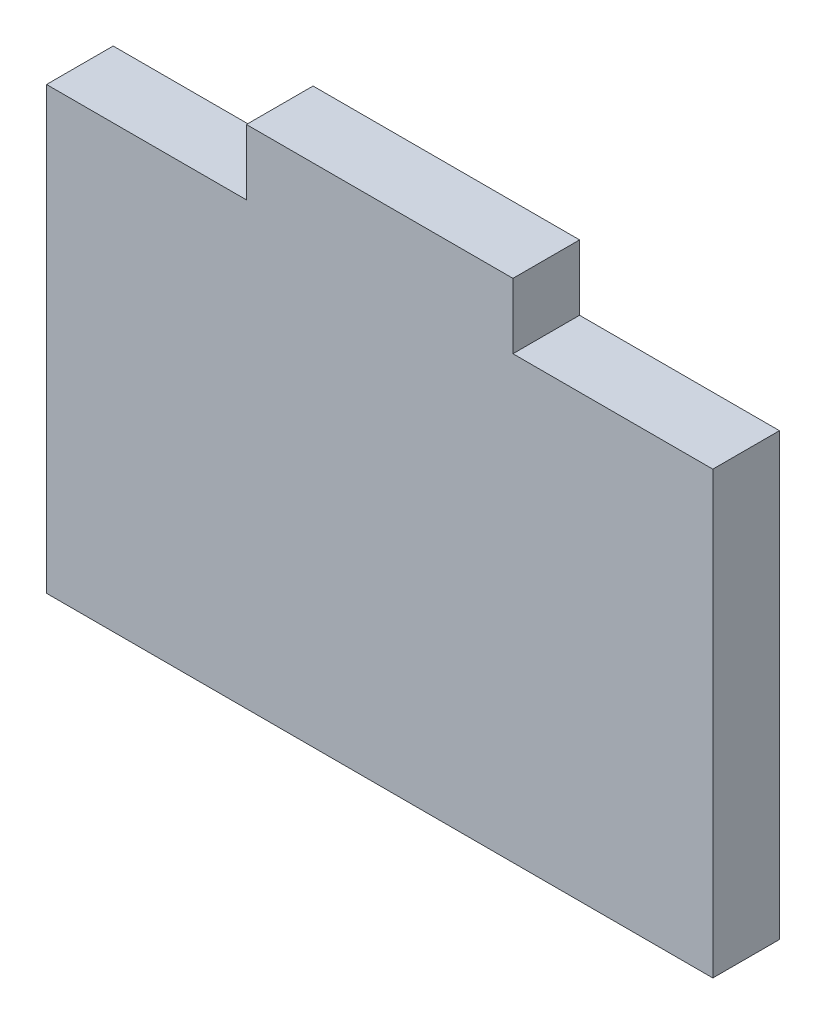
from build123d import *

# Parameters (mm, degrees)
BOSS_EXTRUDE1_DEPTH = 6.35
SKETCH2_W           = 63.888253076
SKETCH2_H           = 53.377
CUT_EXTRUDE1_DEPTH  = 120.979717036


with BuildPart() as part:
    # Sketch1 → Boss-Extrude1 (new body)
    with BuildSketch(Plane.XY):
        Polygon((63.5, 6.223), (63.5, 95.377), (44.45, 95.377), (44.45, 101.6), (19.05, 101.6), (19.05, 95.377), (0, 95.377), (0, 6.223), (19.05, 6.223), (19.05, 0), (44.45, 0), (44.45, 6.223), align=None)
    extrude(amount=BOSS_EXTRUDE1_DEPTH)

    # Sketch2 → Cut-Extrude1 (cut, through all)
    with BuildSketch(Plane.XY.offset(6.35)):
        with Locations((31.944126538, 26.6885)):
            Rectangle(SKETCH2_W, SKETCH2_H)
    extrude(amount=-CUT_EXTRUDE1_DEPTH, mode=Mode.SUBTRACT)


solid = part.part
